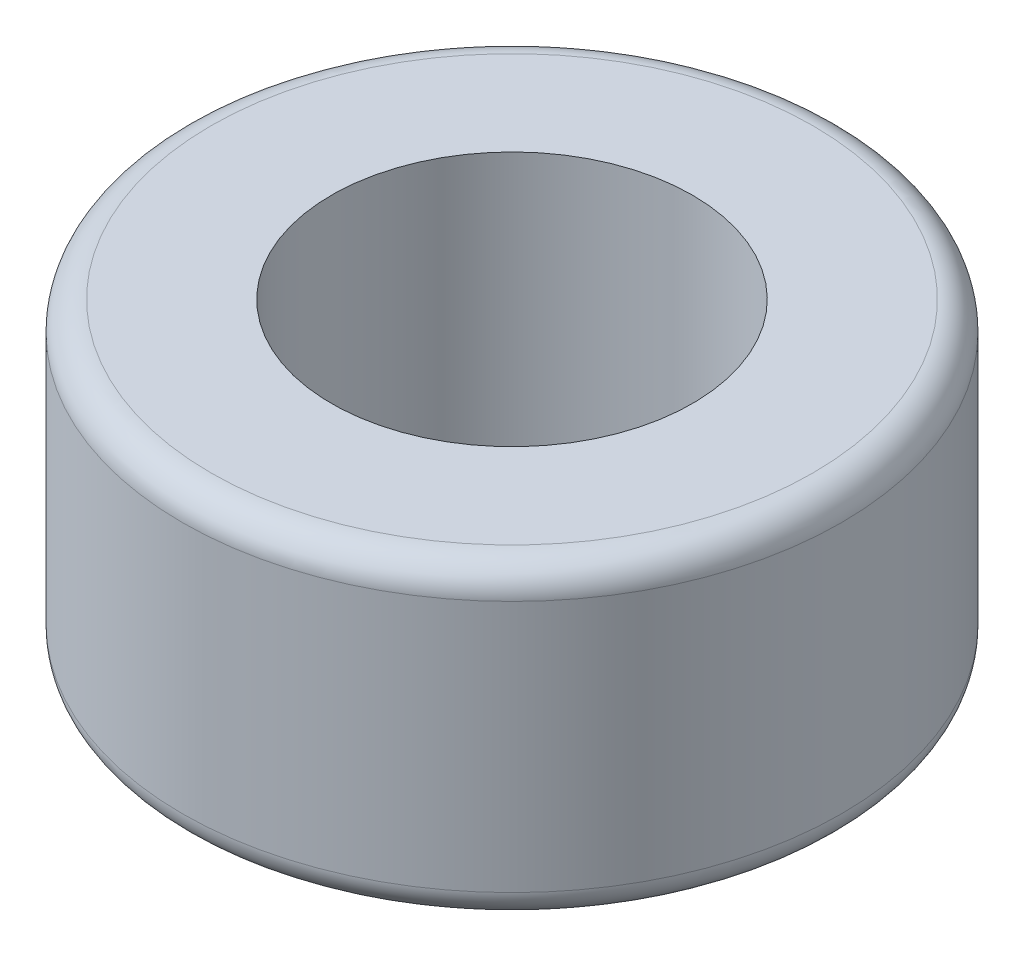
from build123d import *

# Parameters (mm, degrees)
SKETCH1_W = 2.6
SKETCH1_H = 5.4
FILLET1_R = 0.5


with BuildPart() as part:
    # Sketch1 → Revolve1 (revolve)
    with BuildSketch(Plane.XY, mode=Mode.PRIVATE) as revolve1_sk:
        with Locations((-4.45, 0)):
            Rectangle(SKETCH1_W, SKETCH1_H)
    revolve(revolve1_sk.sketch.rotate(Axis((0, 0, 0), (0, 1, 0)), 270), axis=Axis((0, 0, 0), (0, 1, 0)))

    # Fillet1
    fillet1_edges = [part.edges().sort_by_distance(p)[0] for p in [
        (0, 2.7, 5.75),
        (0, -2.7, 5.75),
    ]]
    fillet(fillet1_edges, radius=FILLET1_R)


solid = part.part
